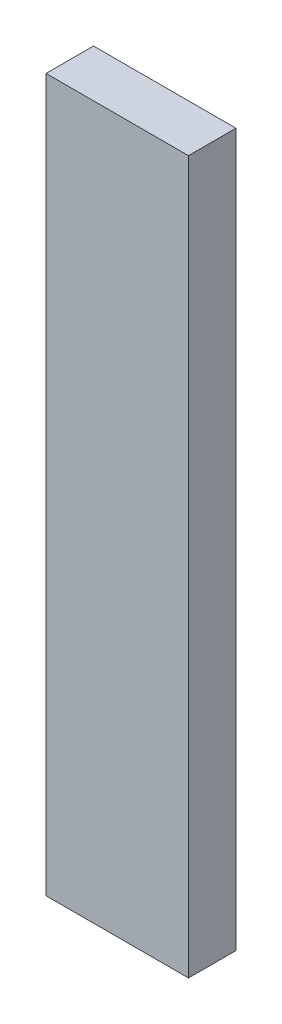
from build123d import *

# Parameters (mm, degrees)
ESQUISSE1_W        = 30
ESQUISSE1_H        = 150
BOSS_EXTRU_1_DEPTH = 5
ESQUISSE2_W        = 30
ESQUISSE2_H        = 150
BOSS_EXTRU_2_DEPTH = 5


with BuildPart() as part:
    # Esquisse1 → Boss.-Extru.1 (new body)
    with BuildSketch(Plane.XY):
        with Locations((7.935577486, 19.591824872)):
            Rectangle(ESQUISSE1_W, ESQUISSE1_H)
        with BuildLine():
            Line((12.435577486, -32.876802094), (10.405267218, -45.796289326))
            ThreePointArc((10.405267218, -45.796289326), (7.935577486, -47.908175128), (5.465887755, -45.796289326))
            Line((5.465887755, -45.796289326), (3.435577486, -32.876802094))
            ThreePointArc((3.435577486, -32.876802094), (1.935577486, -28.908175128), (3.435577486, -24.939548161))
            Line((3.435577486, -24.939548161), (5.465887755, -12.02006093))
            ThreePointArc((5.465887755, -12.02006093), (7.935577486, -9.908175128), (10.405267218, -12.02006093))
            Line((10.405267218, -12.02006093), (12.435577486, -24.939548161))
            ThreePointArc((12.435577486, -24.939548161), (13.935577486, -28.908175128), (12.435577486, -32.876802094))
        make_face(mode=Mode.SUBTRACT)
    extrude(amount=BOSS_EXTRU_1_DEPTH)

    # Esquisse2 → Boss.-Extru.2 (add)
    with BuildSketch(Plane.XY.offset(5)):
        with Locations((7.935577486, 19.591824872)):
            Rectangle(ESQUISSE2_W, ESQUISSE2_H)
    extrude(amount=BOSS_EXTRU_2_DEPTH)


solid = part.part
